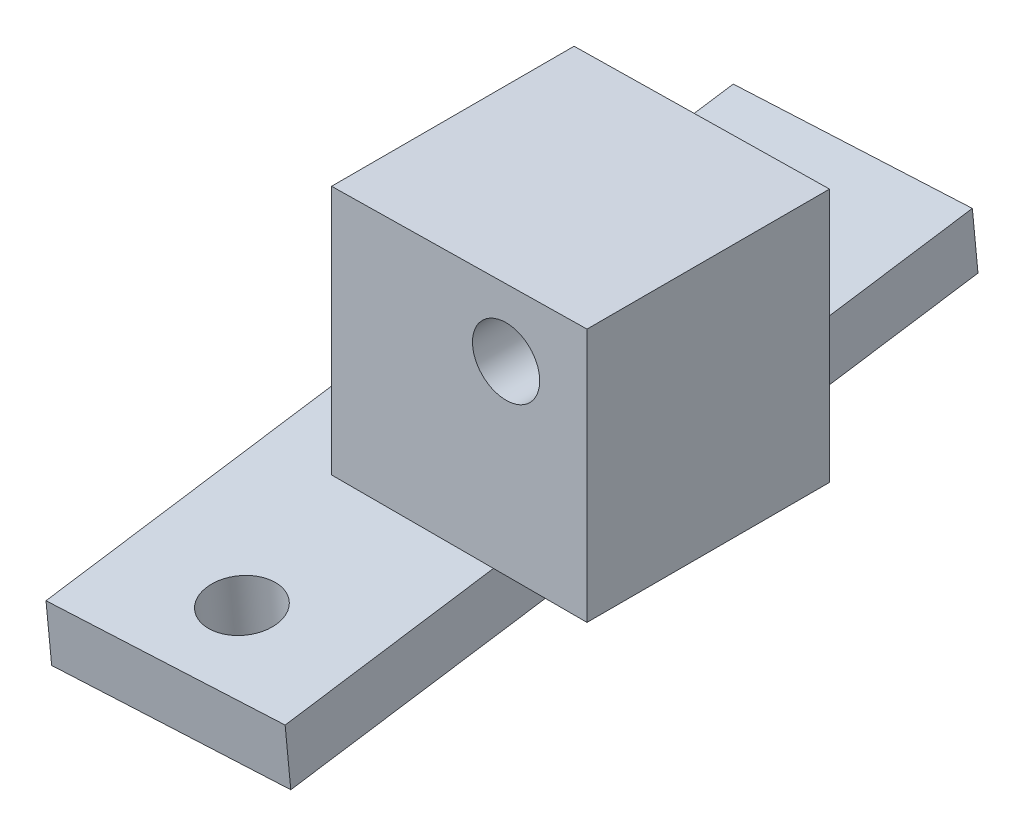
from build123d import *

# Parameters (mm, degrees)
SKETCH1_R           = 3.175
BOSS_EXTRUDE3_DEPTH = 22.9108
SKETCH2_R           = 3.175
BOSS_EXTRUDE4_DEPTH = 5.588
BOSS_EXTRUDE5_DEPTH = 22.9108


with BuildPart() as part:
    # Sketch1 → Boss-Extrude3 (new body)
    with BuildSketch(Plane.XY):
        Polygon((-277.356124969, 264.279078056), (-301.486124969, 263.900029357), (-301.486124969, 241.343772944), (-277.356124969, 241.722821643), align=None)
        with Locations(Location((-285, 257.808220008, 0), (0, 0, 90))):
            Circle(SKETCH1_R, mode=Mode.SUBTRACT)
    extrude(amount=BOSS_EXTRUDE3_DEPTH)

    # Sketch2 → Boss-Extrude4 (add)
    with BuildSketch(Plane(origin=(0, 240.233117527, 23.037314684), x_dir=(1, 0, 0), z_dir=(0, 0.9954334818448494, 0.0954577562183399))):
        Polygon((-310.068865703, 46.86584189), (-306.799735692, -21.636195955), (-285.234279333, -20.607025396), (-288.503409344, 47.895012449), align=None)
        with Locations(Location((-298.922900855, 39.769089631, 0), (0, 0, 270))):
            Circle(SKETCH2_R, mode=Mode.SUBTRACT)
        with Locations(Location((-296.38024418, -13.510273137, 0), (0, 0, 270))):
            Circle(SKETCH2_R, mode=Mode.SUBTRACT)
    extrude(amount=-BOSS_EXTRUDE4_DEPTH)

    # Sketch5 → Boss-Extrude5 (add)
    with BuildSketch(Plane.XY.offset(22.9108)):
        Polygon((-301.486124969, 241.343772944), (-301.486124969, 240.2806727), (-277.356124969, 240.2806727), (-277.356124969, 241.722821643), align=None)
    extrude(amount=-BOSS_EXTRUDE5_DEPTH)


solid = part.part
